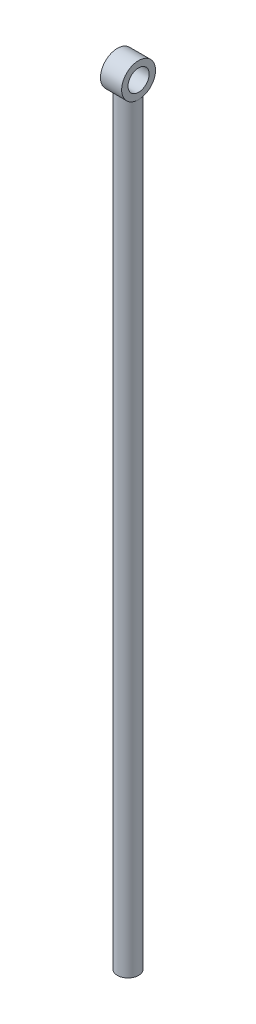
from build123d import *

# Parameters (mm, degrees)
SKETCH1_R           = 5
BOSS_EXTRUDE1_DEPTH = 360
SKETCH2_R           = 8
SKETCH2_R_2         = 5
BOSS_EXTRUDE2_DEPTH = 5


with BuildPart() as part:
    # Sketch1 → Boss-Extrude1 (new body)
    with BuildSketch(Plane(origin=(0, 0, 0), x_dir=(1, 0, 0), z_dir=(0, 1, 0))):
        with Locations(Location((0, 0, 0), (0, 0, 90))):
            Circle(SKETCH1_R)
    extrude(amount=BOSS_EXTRUDE1_DEPTH)

    # Sketch2 → Boss-Extrude2 (add, symmetric)
    with BuildSketch(Plane(origin=(0, 0, 0), x_dir=(0, 0, -1), z_dir=(1, 0, 0))):
        with Locations((0, 366.244997998)):
            Circle(SKETCH2_R)
        with Locations((0, 366.244997998)):
            Circle(SKETCH2_R_2, mode=Mode.SUBTRACT)
    extrude(amount=BOSS_EXTRUDE2_DEPTH, both=True)


solid = part.part
